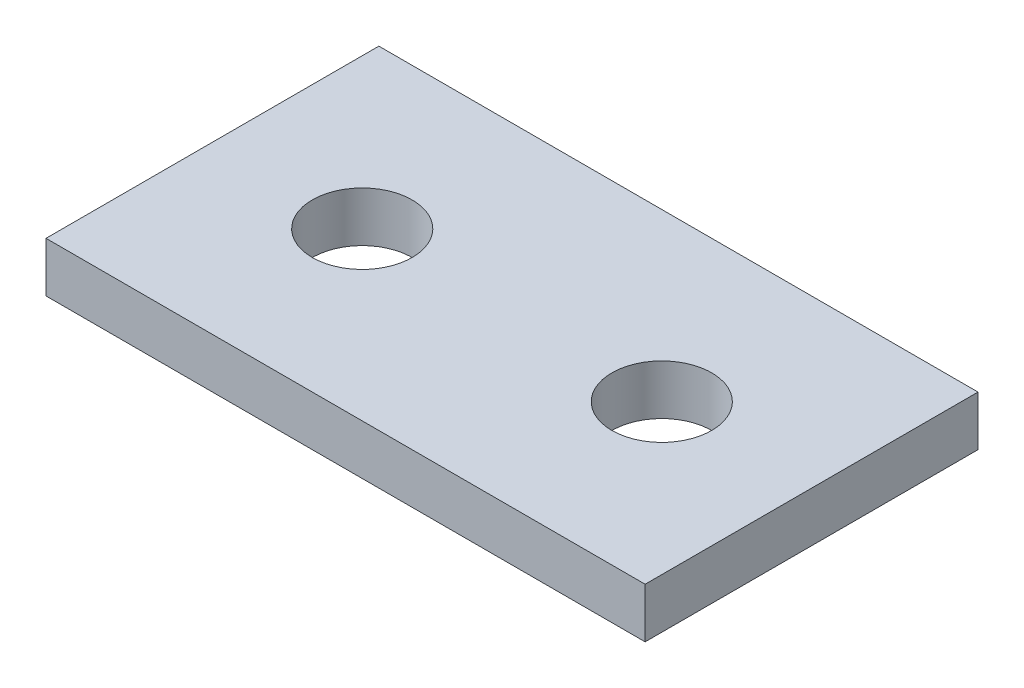
from build123d import *

# Parameters (mm, degrees)
CROQUIS2_W              = 114.3
CROQUIS2_H              = 63.5
SALIENTE_EXTRUIR1_DEPTH = 9.525
CROQUIS3_R              = 9.525
CORTAR_EXTRUIR1_DEPTH   = 9.525


with BuildPart() as part:
    # Croquis2 → Saliente-Extruir1 (new body)
    with BuildSketch(Plane(origin=(0, 0, 0), x_dir=(1, 0, 0), z_dir=(0, 1, 0))):
        with Locations((57.15, -31.75)):
            Rectangle(CROQUIS2_W, CROQUIS2_H)
    extrude(amount=SALIENTE_EXTRUIR1_DEPTH)

    # Croquis3 → Cortar-Extruir1 (cut)
    with BuildSketch(Plane(origin=(0, 9.525, 0), x_dir=(1, 0, 0), z_dir=(0, 1, 0))):
        with Locations(Location((28.575, -31.75, 0), (0, 0, 270))):
            Circle(CROQUIS3_R)
        with Locations(Location((85.725, -31.75, 0), (0, 0, 270))):
            Circle(CROQUIS3_R)
    extrude(amount=-CORTAR_EXTRUIR1_DEPTH, mode=Mode.SUBTRACT)


solid = part.part
